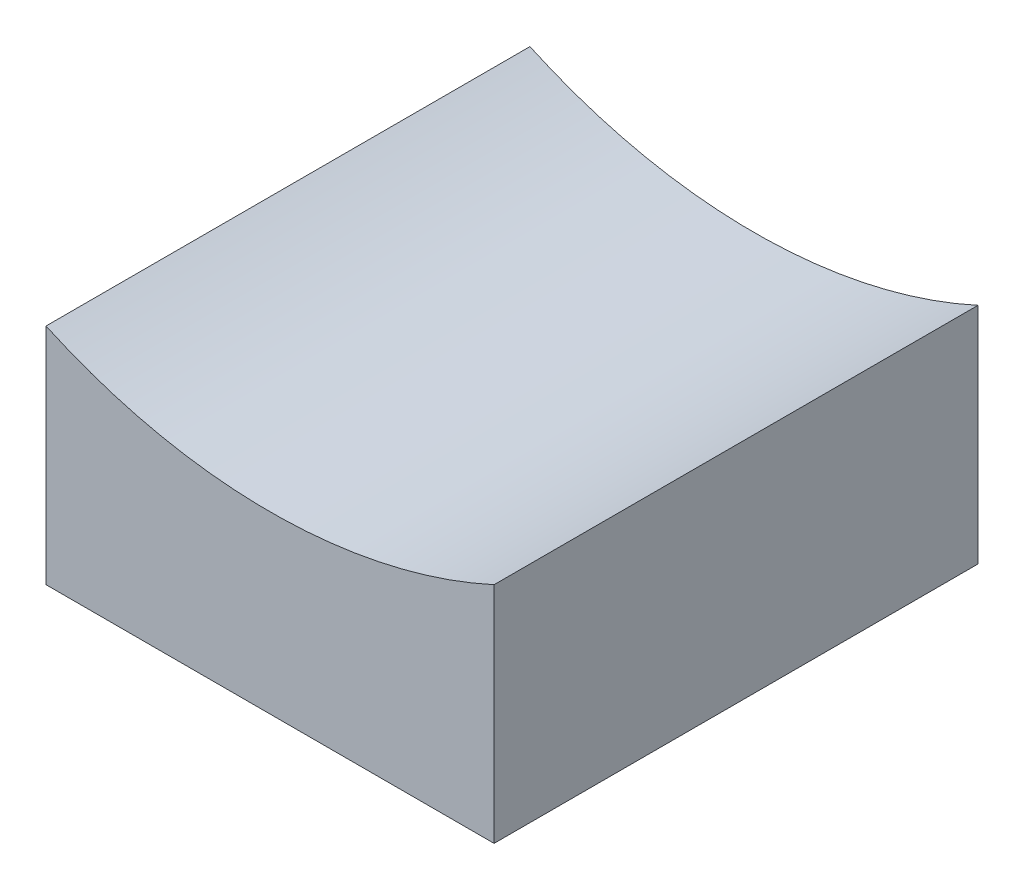
from build123d import *

# Parameters (mm, degrees)
BOSS_EXTRUDE1_DEPTH = 54


with BuildPart() as part:
    # Sketch2 → Boss-Extrude1 (new body)
    with BuildSketch(Plane.XY):
        with BuildLine():
            Line((0, 0), (50, 0))
            Line((50, 0), (50, 25))
            ThreePointArc((50, 25), (25, 19.543560573), (0, 25))
            Line((0, 25), (0, 0))
        make_face()
    extrude(amount=BOSS_EXTRUDE1_DEPTH)


solid = part.part
